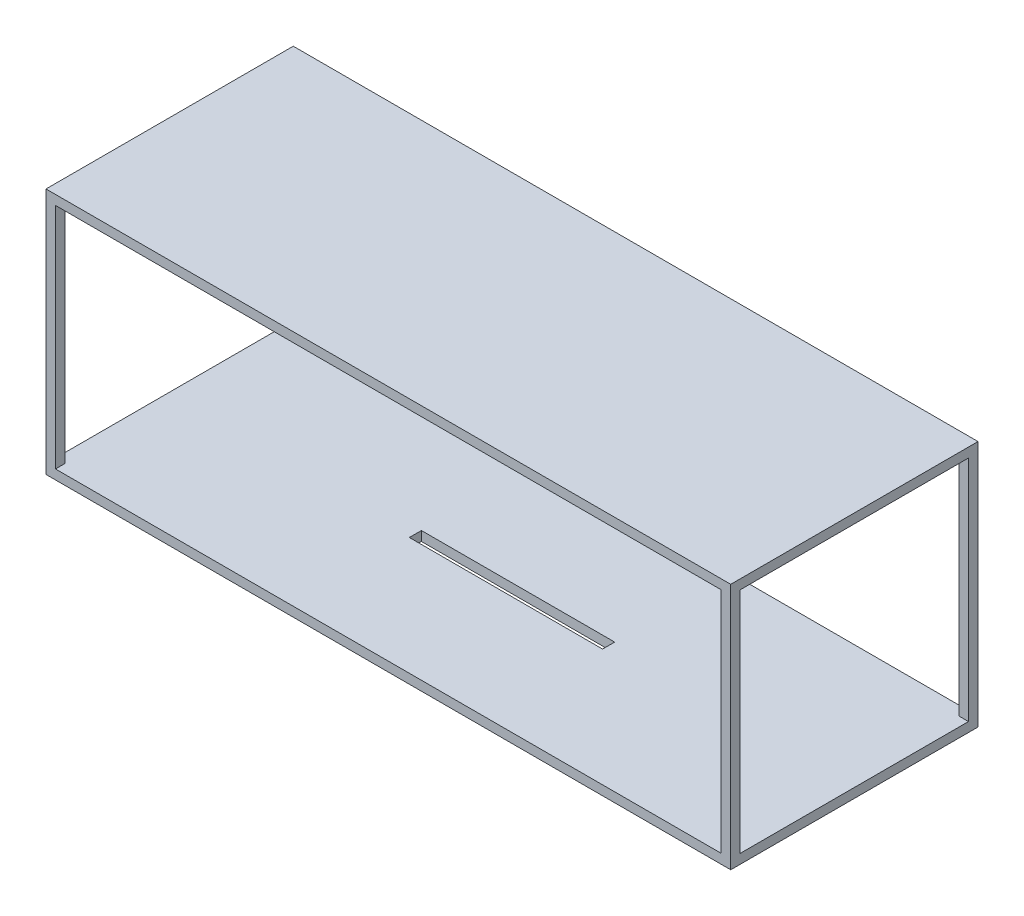
from build123d import *

# Parameters (mm, degrees)
SKETCH1_W           = 360
SKETCH1_H           = 130
BOSS_EXTRUDE1_DEPTH = 130
SHELL1_T            = -5
SKETCH2_W           = 350
SKETCH2_H           = 120
CUT_EXTRUDE1_DEPTH  = 232.354706025
SKETCH3_W           = 101.6
SKETCH3_H           = 6.35
CUT_EXTRUDE2_DEPTH  = 255.803846125


with BuildPart() as part:
    # Sketch1 → Boss-Extrude1 (new body)
    with BuildSketch(Plane.XY):
        Rectangle(SKETCH1_W, SKETCH1_H)
    extrude(amount=BOSS_EXTRUDE1_DEPTH)

    # Shell1
    shell1_openings = [part.faces().sort_by_distance(p)[0] for p in [
        (-180, 0, 65),
        (180, 0, 65),
    ]]
    offset(amount=SHELL1_T, openings=shell1_openings, kind=Kind.INTERSECTION)

    # Sketch2 → Cut-Extrude1 (cut, through all)
    with BuildSketch(Plane.XY.offset(130)):
        Rectangle(SKETCH2_W, SKETCH2_H)
    extrude(amount=-CUT_EXTRUDE1_DEPTH, mode=Mode.SUBTRACT)

    # Sketch3 → Cut-Extrude2 (cut, through all)
    with BuildSketch(Plane(origin=(0, -60, 0), x_dir=(1, 0, 0), z_dir=(0, 1, 0))):
        with Locations((0, -65)):
            Rectangle(SKETCH3_W, SKETCH3_H)
    extrude(amount=-CUT_EXTRUDE2_DEPTH, mode=Mode.SUBTRACT)


solid = part.part
